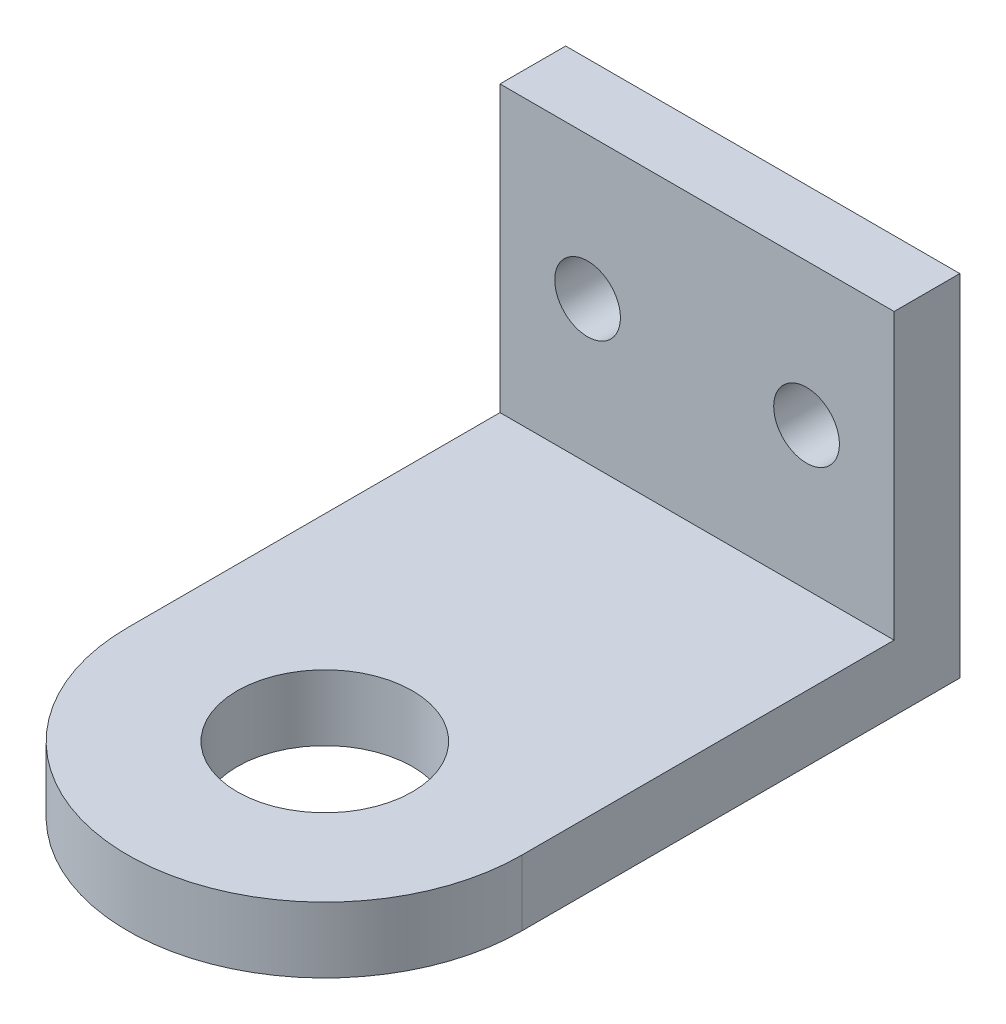
from build123d import *

# Parameters (mm, degrees)
SKETCH_1_W      = 18
SKETCH_1_H      = 16
SKETCH_1_R      = 1.5
EXTRUDE_1_DEPTH = 3
SKETCH_3_R      = 4
EXTRUDE_2_DEPTH = 3


with BuildPart() as part:
    # 草图1 → 凸台-拉伸1 (new body)
    with BuildSketch(Plane.XY):
        Rectangle(SKETCH_1_W, SKETCH_1_H)
        with Locations((-5, 1.5)):
            Circle(SKETCH_1_R, mode=Mode.SUBTRACT)
        with Locations(Location((5, 1.5, 0), (0, 0, 180))):
            Circle(SKETCH_1_R, mode=Mode.SUBTRACT)
    extrude(amount=EXTRUDE_1_DEPTH)

    # 草图3 → 凸台-拉伸2 (add)
    with BuildSketch(Plane.XZ.offset(8)):
        with BuildLine():
            Line((-9, 0), (9, 0))
            Line((9, 0), (9, 20))
            ThreePointArc((9, 20), (0, 29), (-9, 20))
            Line((-9, 20), (-9, 0))
        make_face()
        with Locations(Location((0, 20, 0), (0, 0, 270))):
            Circle(SKETCH_3_R, mode=Mode.SUBTRACT)
    extrude(amount=-EXTRUDE_2_DEPTH)


solid = part.part
